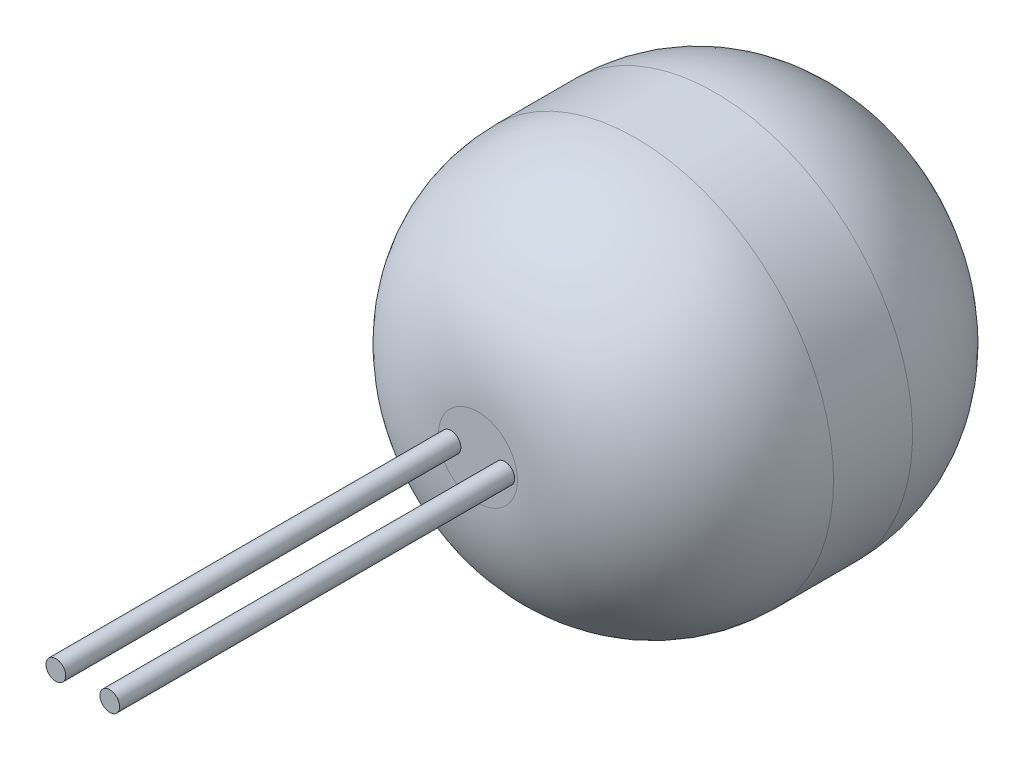
from build123d import *

# Parameters (mm, degrees)
CROQUIS1_W              = 1
CROQUIS1_H              = 2
CROQUIS2_R              = 0.05
SALIENTE_EXTRUIR1_DEPTH = 2
CROQUIS3_R              = 0.05
SALIENTE_EXTRUIR2_DEPTH = 2
REDONDEO1_R             = 0.8


with BuildPart() as part:
    # Croquis1 → Revolución1 (revolve)
    with BuildSketch(Plane.XZ, mode=Mode.PRIVATE) as revoluci_n1_sk:
        with Locations((0.5, 1)):
            Rectangle(CROQUIS1_W, CROQUIS1_H)
    revolve(revoluci_n1_sk.sketch.rotate(Axis((0, 0, 2), (0, 0, -1)), 180), axis=Axis((0, 0, 2), (0, 0, -1)))

    # Croquis2 → Saliente-Extruir1 (add)
    with BuildSketch(Plane.XY.offset(2)):
        with Locations((0.136233706, 0)):
            Circle(CROQUIS2_R)
    extrude(amount=SALIENTE_EXTRUIR1_DEPTH)

    # Croquis3 → Saliente-Extruir2 (add)
    with BuildSketch(Plane.XY.offset(2)):
        with Locations((-0.136275076, 0)):
            Circle(CROQUIS3_R)
    extrude(amount=SALIENTE_EXTRUIR2_DEPTH)

    # Redondeo1
    redondeo1_edges = [part.edges().sort_by_distance(p)[0] for p in [
        (1, 0, 0),
        (1, 0, 2),
    ]]
    fillet(redondeo1_edges, radius=REDONDEO1_R)


solid = part.part
